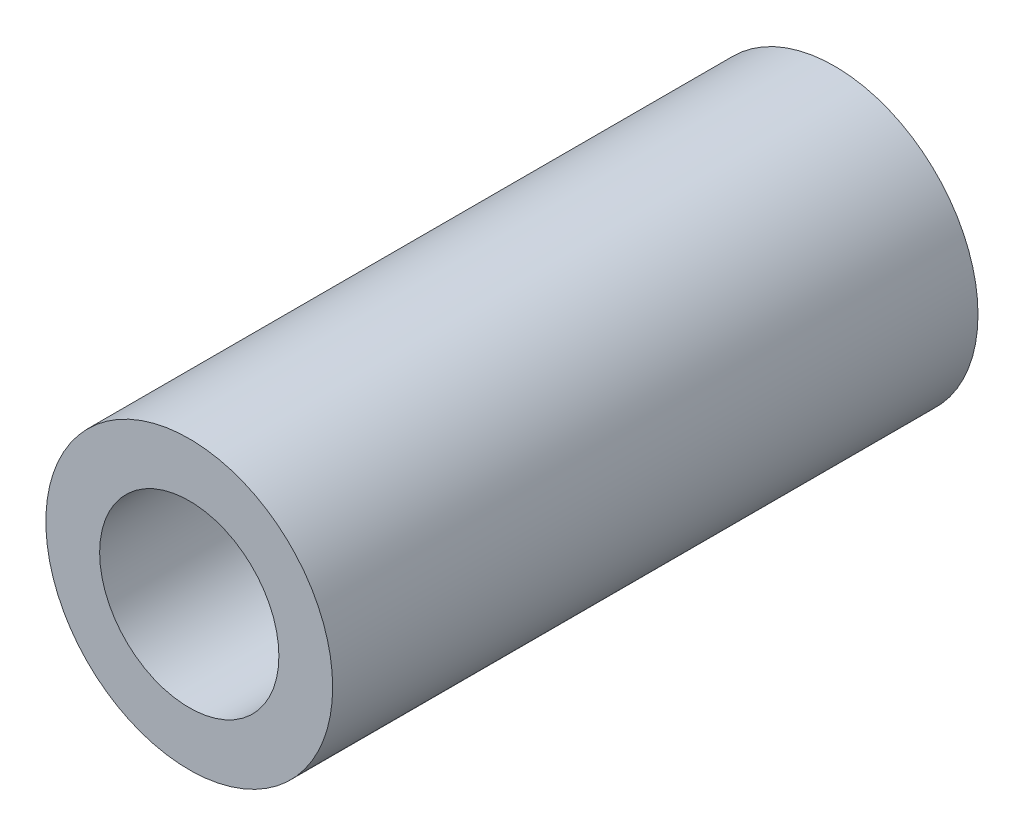
from build123d import *

# Parameters (mm, degrees)
SKETCH1_R           = 4
SKETCH1_R_2         = 2.5
BOSS_EXTRUDE1_DEPTH = 18


with BuildPart() as part:
    # Sketch1 → Boss-Extrude1 (new body)
    with BuildSketch(Plane.XY):
        Circle(SKETCH1_R)
        Circle(SKETCH1_R_2, mode=Mode.SUBTRACT)
    extrude(amount=BOSS_EXTRUDE1_DEPTH)


solid = part.part
